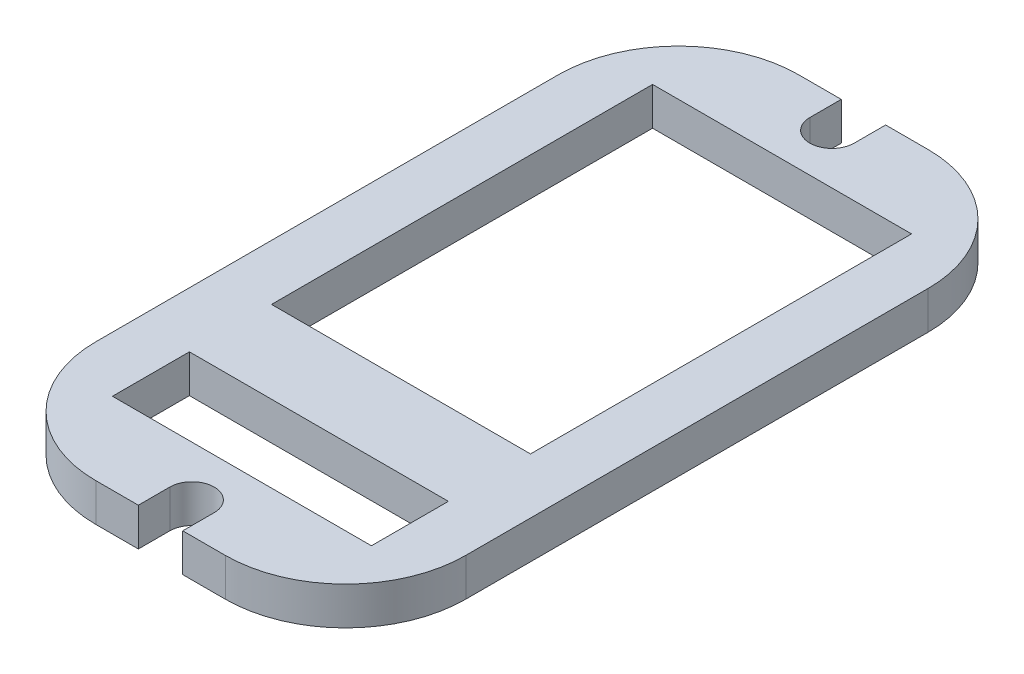
from build123d import *

# Parameters (mm, degrees)
SKETCH2_W           = 7
SKETCH2_H           = 10.3
SKETCH2_H_2         = 2.08
BOSS_EXTRUDE1_DEPTH = 1.026


with BuildPart() as part:
    # Sketch2 → Boss-Extrude1 (new body)
    with BuildSketch(Plane(origin=(0, 0, 0), x_dir=(1, 0, 0), z_dir=(0, 1, 0))):
        with BuildLine():
            Line((-0.6, 9.5), (-1.75, 9.5))
            ThreePointArc((-1.75, 9.5), (-4.048097039, 8.548097039), (-5, 6.25))
            Line((-5, 6.25), (-5, -6.25))
            ThreePointArc((-5, -6.25), (-4.048097039, -8.548097039), (-1.75, -9.5))
            Line((-1.75, -9.5), (-0.6, -9.5))
            Line((-0.6, -9.5), (-0.6, -8.65))
            ThreePointArc((-0.6, -8.65), (0, -8.05), (0.6, -8.65))
            Line((0.6, -8.65), (0.6, -9.5))
            Line((0.6, -9.5), (1.75, -9.5))
            ThreePointArc((1.75, -9.5), (4.048097039, -8.548097039), (5, -6.25))
            Line((5, -6.25), (5, 6.25))
            ThreePointArc((5, 6.25), (4.048097039, 8.548097039), (1.75, 9.5))
            Line((1.75, 9.5), (0.6, 9.5))
            Line((0.6, 9.5), (0.6, 8.65))
            ThreePointArc((0.6, 8.65), (0, 8.05), (-0.6, 8.65))
            Line((-0.6, 8.65), (-0.6, 9.5))
        make_face()
        with Locations((0, 2.15)):
            Rectangle(SKETCH2_W, SKETCH2_H, mode=Mode.SUBTRACT)
        with Locations((0, -6.26)):
            Rectangle(SKETCH2_W, SKETCH2_H_2, mode=Mode.SUBTRACT)
    extrude(amount=BOSS_EXTRUDE1_DEPTH)


solid = part.part
